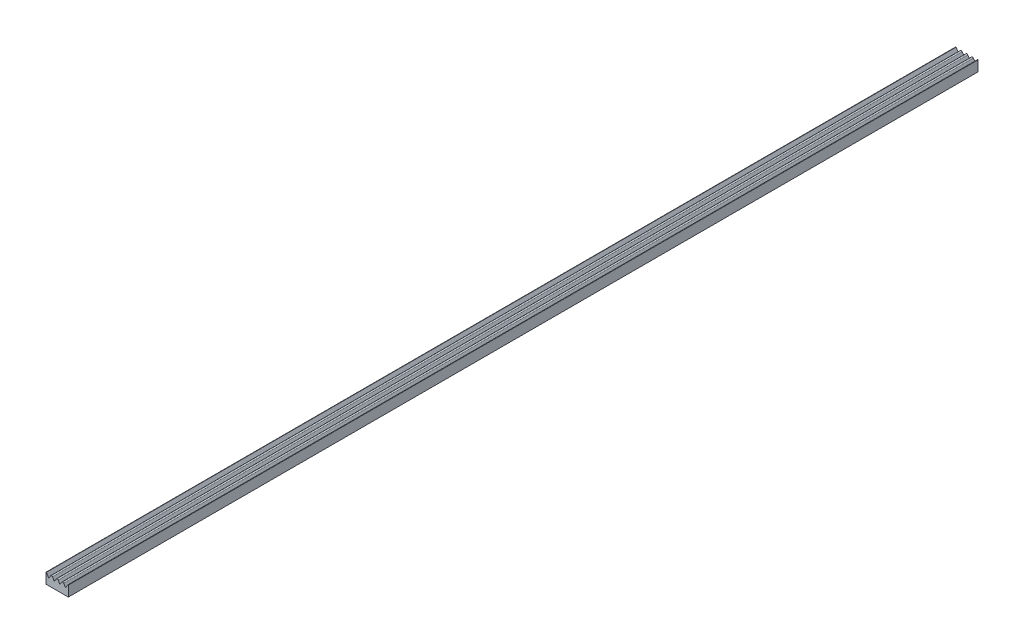
from build123d import *

# Parameters (mm, degrees)
BOSS_EXTRUDE1_DEPTH = 517.525


with BuildPart() as part:
    # Sketch1 → Boss-Extrude1 (new body)
    with BuildSketch(Plane.XY):
        with BuildLine():
            Line((0, 0), (-12.7, 0))
            Line((-12.7, 0), (-12.7, 5.907176879))
            ThreePointArc((-12.7, 5.907176879), (-12.608011679, 6.02925547), (-12.465304215, 5.974486745))
            Line((-12.465304215, 5.974486745), (-11.1125, 3.81))
            Line((-11.1125, 3.81), (-10.063478923, 5.488433723))
            ThreePointArc((-10.063478923, 5.488433723), (-9.525, 5.786884396), (-8.986521077, 5.488433723))
            Line((-8.986521077, 5.488433723), (-7.9375, 3.81))
            Line((-7.9375, 3.81), (-6.888478923, 5.488433723))
            ThreePointArc((-6.888478923, 5.488433723), (-6.35, 5.786884396), (-5.811521077, 5.488433723))
            Line((-5.811521077, 5.488433723), (-4.7625, 3.81))
            Line((-4.7625, 3.81), (-3.713478923, 5.488433723))
            ThreePointArc((-3.713478923, 5.488433723), (-3.175, 5.786884396), (-2.636521077, 5.488433723))
            Line((-2.636521077, 5.488433723), (-1.5875, 3.81))
            Line((-1.5875, 3.81), (-0.234695785, 5.974486745))
            ThreePointArc((-0.234695785, 5.974486745), (-0.091988321, 6.02925547), (0, 5.907176879))
            Line((0, 5.907176879), (0, 0))
        make_face()
    extrude(amount=BOSS_EXTRUDE1_DEPTH)


solid = part.part
